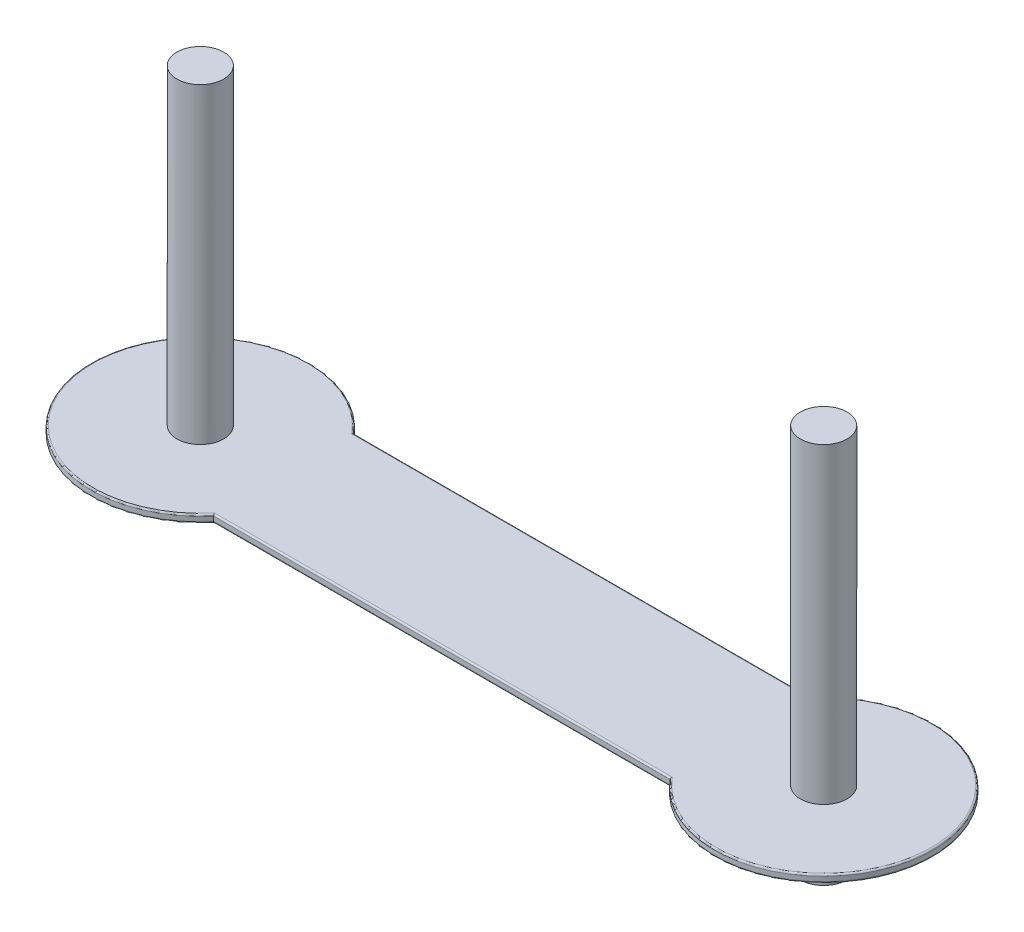
from build123d import *

# Parameters (mm, degrees)
BOSS_EXTRUDE1_DEPTH      = 3.175
SKETCH2_R                = 9.525
BOSS_EXTRUDE2_DEPTH      = 127
BOSS_EXTRUDE3_DEPTH      = 127
BOSS_EXTRUDE3_DEPTH_BACK = 28.575
SKETCH4_R                = 9.525
FILLET3_R                = 0.635


with BuildPart() as part:
    # Sketch1 → Boss-Extrude1 (new body)
    with BuildSketch(Plane(origin=(0, 0, 0), x_dir=(1, 0, 0), z_dir=(0, 1, 0))):
        with BuildLine():
            Line((92.951918189, 28.575), (-92.951918189, 28.575))
            ThreePointArc((-92.951918189, 28.575), (-171.45, 0), (-92.951918189, -28.575))
            Line((-92.951918189, -28.575), (92.951918189, -28.575))
            ThreePointArc((92.951918189, -28.575), (171.45, 0), (92.951918189, 28.575))
        make_face()
    extrude(amount=BOSS_EXTRUDE1_DEPTH)

    # Sketch2 → Boss-Extrude2 (add)
    with BuildSketch(Plane(origin=(0, 3.175, 0), x_dir=(1, 0, 0), z_dir=(0, 1, 0))):
        with Locations(Location((-127, 0, 0), (0, 0, 90))):
            Circle(SKETCH2_R)
    extrude(amount=BOSS_EXTRUDE2_DEPTH)

    # Sketch4 → Boss-Extrude3 (add, two sides: drawn at the far end of the back side and taken through both)
    with BuildSketch(Plane(origin=(0, 3.175, 0), x_dir=(1, 0, 0), z_dir=(0, 1, 0)).offset(-BOSS_EXTRUDE3_DEPTH_BACK)):
        with Locations(Location((127, 0, 0), (0, 0, 270))):
            Circle(SKETCH4_R)
    extrude(amount=BOSS_EXTRUDE3_DEPTH + BOSS_EXTRUDE3_DEPTH_BACK)

    # Fillet3
    fillet3_edges = [part.edges().sort_by_distance(p)[0] for p in [
        (171.45, 3.175, 0),
        (0, 3.175, -28.575),
        (-171.45, 3.175, 0),
        (0, 0, -28.575),
        (171.45, 0, 0),
        (0, 0, 28.575),
        (-171.45, 0, 0),
        (0, 3.175, 28.575),
    ]]
    fillet(fillet3_edges, radius=FILLET3_R)


solid = part.part
